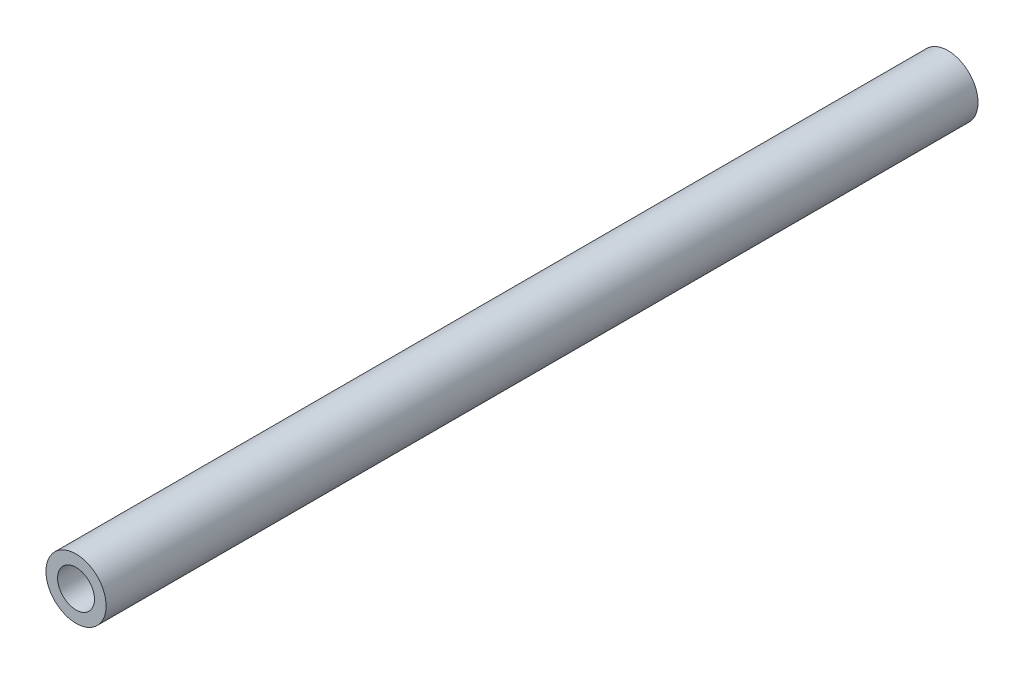
from build123d import *

# Parameters (mm, degrees)
IZIM1_R                     = 10.35
IZIM1_R_2                   = 6.35
Y_KSEKLIK_EKSTR_ZYON1_DEPTH = 300


with BuildPart() as part:
    # Çizim1 → Yükseklik-Ekstrüzyon1 (new body)
    with BuildSketch(Plane.XY):
        Circle(IZIM1_R)
        Circle(IZIM1_R_2, mode=Mode.SUBTRACT)
    extrude(amount=Y_KSEKLIK_EKSTR_ZYON1_DEPTH)


solid = part.part
